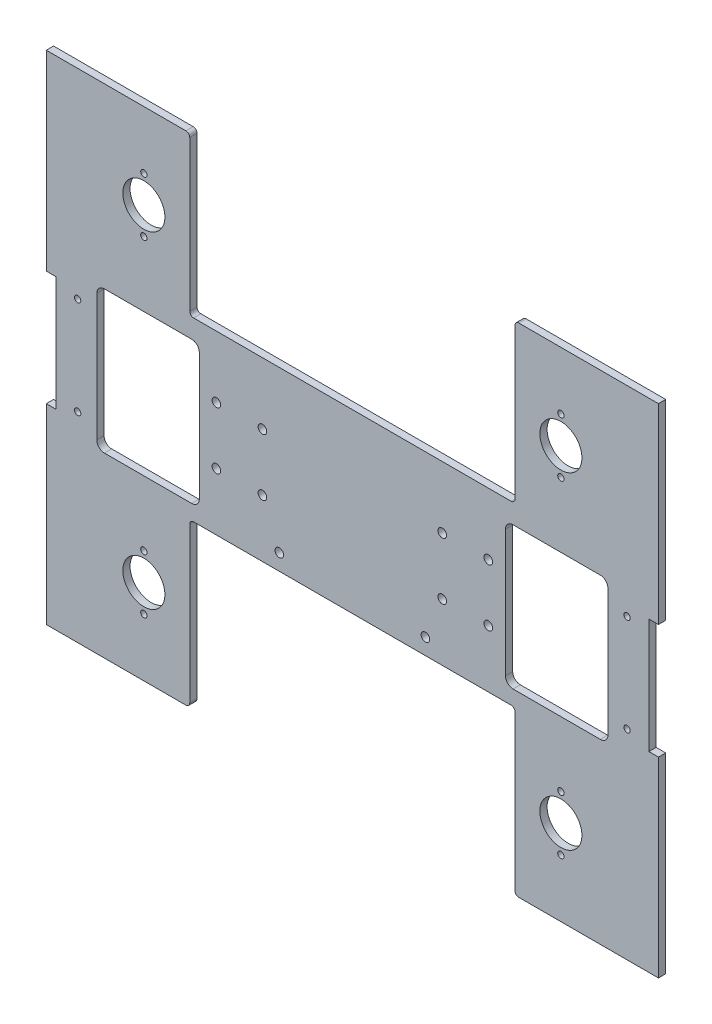
from build123d import *

# Parameters (mm, degrees)
SKETCH2_R           = 1.65
SKETCH2_R_2         = 11
SKETCH2_R_3         = 2.25
BOSS_EXTRUDE1_DEPTH = 3.8


with BuildPart() as part:
    # Sketch2 → Boss-Extrude1 (new body)
    with BuildSketch(Plane.XY):
        with BuildLine():
            Line((-160, 155), (-87, 155))
            ThreePointArc((-87, 155), (-85.585786438, 154.414213562), (-85, 153))
            Line((-85, 153), (-85, 74.308795954))
            ThreePointArc((-85, 74.308795954), (-84.414213562, 72.894582392), (-83, 72.308795954))
            Line((-83, 72.308795954), (83, 72.308795954))
            ThreePointArc((83, 72.308795954), (84.414213562, 72.894582392), (85, 74.308795954))
            Line((85, 74.308795954), (85, 153))
            ThreePointArc((85, 153), (85.585786438, 154.414213562), (87, 155))
            Line((87, 155), (160, 155))
            Line((160, 155), (160, 55))
            Line((160, 55), (155, 55))
            Line((155, 55), (155, -5))
            Line((155, -5), (160, -5))
            Line((160, -5), (160, -105))
            Line((160, -105), (87, -105))
            ThreePointArc((87, -105), (85.585786438, -104.414213562), (85, -103))
            Line((85, -103), (85, -22))
            ThreePointArc((85, -22), (84.414213562, -20.585786438), (83, -20))
            Line((83, -20), (-83, -20))
            ThreePointArc((-83, -20), (-84.414213562, -20.585786438), (-85, -22))
            Line((-85, -22), (-85, -103))
            ThreePointArc((-85, -103), (-85.585786438, -104.414213562), (-87, -105))
            Line((-87, -105), (-160, -105))
            Line((-160, -105), (-160, -5))
            Line((-160, -5), (-155, -5))
            Line((-155, -5), (-155, 55))
            Line((-155, 55), (-160, 55))
            Line((-160, 55), (-160, 155))
        make_face()
        with Locations(Location((-108.992804496, 124.770936608, 0), (0, 0, 180))):
            Circle(SKETCH2_R, mode=Mode.SUBTRACT)
        with Locations(Location((-108.992804496, 96.101330956, 0), (0, 0, 180))):
            Circle(SKETCH2_R, mode=Mode.SUBTRACT)
        with Locations(Location((108.992804496, 124.770936608, 0), (0, 0, 180))):
            Circle(SKETCH2_R, mode=Mode.SUBTRACT)
        with Locations(Location((108.992804496, 96.101330956, 0), (0, 0, 180))):
            Circle(SKETCH2_R, mode=Mode.SUBTRACT)
        with Locations(Location((108.992804496, 110.436133782, 0), (0, 0, 180))):
            Circle(SKETCH2_R_2, mode=Mode.SUBTRACT)
        with Locations(Location((-108.992804496, 110.436133782, 0), (0, 0, 180))):
            Circle(SKETCH2_R_2, mode=Mode.SUBTRACT)
        with Locations(Location((143.59774802, -0.5, 0), (0, 0, 180))):
            Circle(SKETCH2_R, mode=Mode.SUBTRACT)
        with Locations(Location((143.59774802, 50.5, 0), (0, 0, 180))):
            Circle(SKETCH2_R, mode=Mode.SUBTRACT)
        with Locations(Location((-143.59774802, -0.5, 0), (0, 0, 180))):
            Circle(SKETCH2_R, mode=Mode.SUBTRACT)
        with Locations(Location((-143.59774802, 50.5, 0), (0, 0, 180))):
            Circle(SKETCH2_R, mode=Mode.SUBTRACT)
        with Locations(Location((-47, 10.055, 0), (0, 0, 180))):
            Circle(SKETCH2_R_3, mode=Mode.SUBTRACT)
        with Locations(Location((-47, 39.945, 0), (0, 0, 180))):
            Circle(SKETCH2_R_3, mode=Mode.SUBTRACT)
        with Locations(Location((-71.06, 39.945, 0), (0, 0, 180))):
            Circle(SKETCH2_R_3, mode=Mode.SUBTRACT)
        with Locations(Location((-71.06, 10.055, 0), (0, 0, 180))):
            Circle(SKETCH2_R_3, mode=Mode.SUBTRACT)
        with Locations(Location((71.06, 10.055, 0), (0, 0, 180))):
            Circle(SKETCH2_R_3, mode=Mode.SUBTRACT)
        with Locations(Location((47, 10.055, 0), (0, 0, 180))):
            Circle(SKETCH2_R_3, mode=Mode.SUBTRACT)
        with Locations(Location((47, 39.945, 0), (0, 0, 180))):
            Circle(SKETCH2_R_3, mode=Mode.SUBTRACT)
        with Locations(Location((71.06, 39.945, 0), (0, 0, 180))):
            Circle(SKETCH2_R_3, mode=Mode.SUBTRACT)
        with Locations(Location((108.992804496, -74.770936608, 0), (0, 0, 180))):
            Circle(SKETCH2_R, mode=Mode.SUBTRACT)
        with Locations(Location((108.992804496, -46.101330956, 0), (0, 0, 180))):
            Circle(SKETCH2_R, mode=Mode.SUBTRACT)
        with Locations(Location((108.992804496, -60.436133782, 0), (0, 0, 180))):
            Circle(SKETCH2_R_2, mode=Mode.SUBTRACT)
        with Locations(Location((-108.992804496, -60.436133782, 0), (0, 0, 180))):
            Circle(SKETCH2_R_2, mode=Mode.SUBTRACT)
        with Locations(Location((-108.992804496, -46.101330956, 0), (0, 0, 180))):
            Circle(SKETCH2_R, mode=Mode.SUBTRACT)
        with Locations(Location((-108.992804496, -74.770936608, 0), (0, 0, 180))):
            Circle(SKETCH2_R, mode=Mode.SUBTRACT)
        with Locations(Location((38.179918963, -11.563765186, 0), (0, 0, 180))):
            Circle(SKETCH2_R_3, mode=Mode.SUBTRACT)
        with Locations(Location((-38.179918963, -11.563765186, 0), (0, 0, 180))):
            Circle(SKETCH2_R_3, mode=Mode.SUBTRACT)
        with BuildLine():
            Line((-84, 62.171403079), (-129.59774802, 62.171403079))
            ThreePointArc((-129.59774802, 62.171403079), (-132.426175145, 60.999830204), (-133.59774802, 58.171403079))
            Line((-133.59774802, 58.171403079), (-133.59774802, -8.171403079))
            ThreePointArc((-133.59774802, -8.171403079), (-132.426175145, -10.999830204), (-129.59774802, -12.171403079))
            Line((-129.59774802, -12.171403079), (-84, -12.171403079))
            ThreePointArc((-84, -12.171403079), (-81.171572875, -10.999830204), (-80, -8.171403079))
            Line((-80, -8.171403079), (-80, 58.171403079))
            ThreePointArc((-80, 58.171403079), (-81.171572875, 60.999830204), (-84, 62.171403079))
        make_face(mode=Mode.SUBTRACT)
        with BuildLine():
            Line((84, 62.171403079), (129.59774802, 62.171403079))
            ThreePointArc((129.59774802, 62.171403079), (132.426175145, 60.999830204), (133.59774802, 58.171403079))
            Line((133.59774802, 58.171403079), (133.59774802, -8.171403079))
            ThreePointArc((133.59774802, -8.171403079), (132.426175145, -10.999830204), (129.59774802, -12.171403079))
            Line((129.59774802, -12.171403079), (84, -12.171403079))
            ThreePointArc((84, -12.171403079), (81.171572875, -10.999830204), (80, -8.171403079))
            Line((80, -8.171403079), (80, 58.171403079))
            ThreePointArc((80, 58.171403079), (81.171572875, 60.999830204), (84, 62.171403079))
        make_face(mode=Mode.SUBTRACT)
    extrude(amount=BOSS_EXTRUDE1_DEPTH)


solid = part.part
